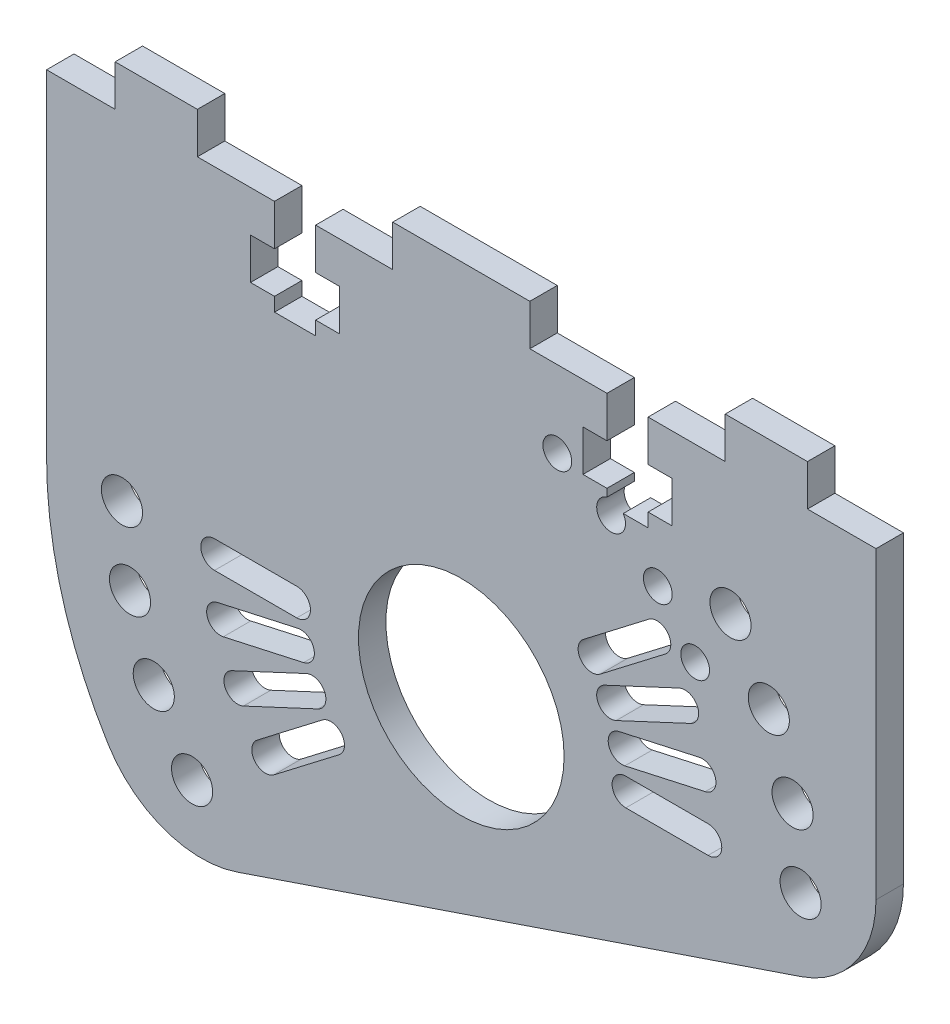
from build123d import *

# Parameters (mm, degrees)
SKETCH_1_W               = 61.5
SKETCH_1_H               = 55
SKETCH_1_R               = 7.5
EXTRUDE_1_DEPTH          = 2
SKETCH_2_R               = 1.5
SKETCH_2_R_2             = 1.05
CUT_EXTRUDE_1_DEPTH      = 42.301483024
PATTERN_CIRCULAR_1_COUNT = 4
PATTERN_CIRCULAR_1_ANGLE = 37.5
CUT_EXTRUDE_2_DEPTH      = 42.301483024
FILLET_1_R               = 8
SKETCH_5_W               = 5
SKETCH_5_H               = 3
CUT_EXTRUDE_3_DEPTH      = 41.930581622


with BuildPart() as part:
    # 草图1 → 凸台-拉伸1 (new body)
    with BuildSketch(Plane.XY):
        Rectangle(SKETCH_1_W, SKETCH_1_H)
        Circle(SKETCH_1_R, mode=Mode.SUBTRACT)
    extrude(amount=EXTRUDE_1_DEPTH)

    # 草图2 → 切除-拉伸1 (cut, through all)
    with BuildSketch(Plane.XY.offset(2)):
        with Locations((24.75, 0)):
            Circle(SKETCH_2_R)
        with Locations((-24.75, 0)):
            Circle(SKETCH_2_R)
        with Locations((17.06, 10.73)):
            Circle(SKETCH_2_R_2)
        with BuildLine():
            Line((-18, 1), (-12, 1))
            ThreePointArc((-12, 1), (-11, 0), (-12, -1))
            Line((-12, -1), (-18, -1))
            ThreePointArc((-18, -1), (-19, 0), (-18, 1))
        make_face()
        with BuildLine():
            Line((12, 1), (18, 1))
            ThreePointArc((18, 1), (19, 0), (18, -1))
            Line((18, -1), (12, -1))
            ThreePointArc((12, -1), (11, 0), (12, 1))
        make_face()
    cut_extrude_1 = extrude(amount=-CUT_EXTRUDE_1_DEPTH, mode=Mode.SUBTRACT)

    # 阵列(圆周)1: 切除-拉伸1 ×4 about axis
    pattern_circular_1_axis = Axis((0, 0, 0), (0, 0, 1))
    for i in range(1, PATTERN_CIRCULAR_1_COUNT):
        add(cut_extrude_1.rotate(pattern_circular_1_axis, i * PATTERN_CIRCULAR_1_ANGLE / (PATTERN_CIRCULAR_1_COUNT - 1)), mode=Mode.SUBTRACT)

    # 草图3 → 切除-拉伸2 (cut, through all)
    with BuildSketch(Plane.XY.offset(2)):
        with BuildLine():
            Line((-21.720093373, -21.05469173), (30.048992854, -3.481454933))
            ThreePointArc((30.048992854, -3.481454933), (30.199706405, -1.743626417), (30.25, 0))
            Line((30.25, 0), (30.25, 27.5))
            Line((30.25, 27.5), (30.75, 27.5))
            Line((30.75, 27.5), (30.75, 0))
            Line((30.75, 0), (30.75, -27.5))
            Line((30.75, -27.5), (-30.75, -27.5))
            Line((-30.75, -27.5), (-30.75, 0))
            Line((-30.75, 0), (-30.75, 27.5))
            Line((-30.75, 27.5), (-30.25, 27.5))
            Line((-30.25, 27.5), (-30.25, 0))
            ThreePointArc((-30.25, 0), (-28.036541553, -11.358469867), (-21.720093373, -21.05469173))
        make_face()
    extrude(amount=-CUT_EXTRUDE_2_DEPTH, mode=Mode.SUBTRACT)

    # 圆角1
    fillet_1_edges = [part.edges().sort_by_distance(p)[0] for p in [
        (30.048992854, -3.481454933, 1),
        (-21.720093373, -21.05469173, 1),
    ]]
    fillet(fillet_1_edges, radius=FILLET_1_R)

    # 草图5 → 切除-拉伸3 (cut, through all)
    with BuildSketch(Plane.XY.offset(2)):
        with Locations((-27.75, 26)):
            Rectangle(SKETCH_5_W, SKETCH_5_H)
        Polygon((-19.25, 27.5), (-5, 27.5), (-5, 24.5), (-10.625, 24.5), (-10.625, 21.5), (-8.875, 21.5), (-8.875, 18.5), (-10.625, 18.5), (-10.625, 17.5), (-13.625, 17.5), (-13.625, 18.5), (-15.375, 18.5), (-15.375, 21.5), (-13.625, 21.5), (-13.625, 24.5), (-19.25, 24.5), align=None)
        Polygon((5, 27.5), (19.25, 27.5), (19.25, 24.5), (13.625, 24.5), (13.625, 21.5), (15.375, 21.5), (15.375, 18.5), (13.625, 18.5), (13.625, 17.5), (10.625, 17.5), (10.625, 18.5), (8.875, 18.5), (8.875, 21.5), (10.625, 21.5), (10.625, 24.5), (5, 24.5), align=None)
        with Locations((27.75, 26)):
            Rectangle(SKETCH_5_W, SKETCH_5_H)
    extrude(amount=-CUT_EXTRUDE_3_DEPTH, mode=Mode.SUBTRACT)


solid = part.part
